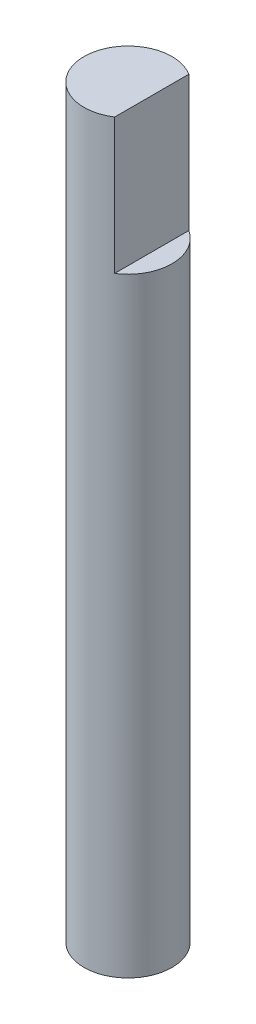
from build123d import *

# Parameters (mm, degrees)
SKETCH1_R           = 0.65
BOSS_EXTRUDE1_DEPTH = 11
CUT_EXTRUDE1_DEPTH  = 2


with BuildPart() as part:
    # Sketch1 → Boss-Extrude1 (new body)
    with BuildSketch(Plane(origin=(0, 0, 0), x_dir=(1, 0, 0), z_dir=(0, 1, 0))):
        with Locations(Location((0, 0, 0), (0, 0, 270))):
            Circle(SKETCH1_R)
    extrude(amount=BOSS_EXTRUDE1_DEPTH)

    # Sketch2 → Cut-Extrude1 (cut)
    with BuildSketch(Plane(origin=(0, 11, 0), x_dir=(1, 0, 0), z_dir=(0, 1, 0))):
        Polygon((0.35, 13.668324631), (0.35, 0.547722558), (0.35, -0.547722558), (0.35, -13.668324631), (26.591204146, -13.668324631), (26.591204146, 13.668324631), align=None)
    extrude(amount=-CUT_EXTRUDE1_DEPTH, mode=Mode.SUBTRACT)


solid = part.part
